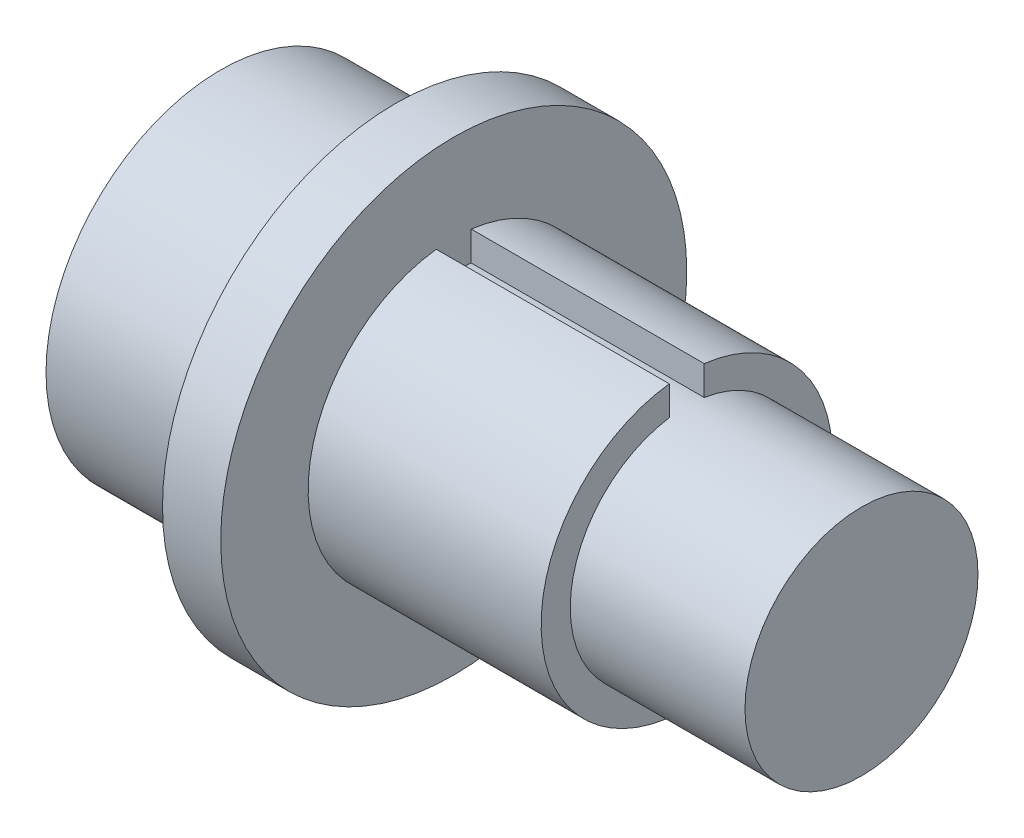
from build123d import *

# Parameters (mm, degrees)
CUT_EXTRUDE1_DEPTH = 40


with BuildPart() as part:
    # Sketch1 → Revolve2 (revolve)
    with BuildSketch(Plane.XY, mode=Mode.PRIVATE) as revolve2_sk:
        Polygon((30, 30), (30, 40), (40, 40), (40, 25), (80, 25), (80, 20), (110, 20), (110, 0), (51.715920118, 0), (0, 0), (0, 30), align=None)
    revolve(revolve2_sk.sketch.rotate(Axis((-14.684767441, 0, 0), (1, 0, 0)), 90), axis=Axis((-14.684767441, 0, 0), (1, 0, 0)))

    # Sketch2 → Cut-Extrude1 (cut)
    with BuildSketch(Plane(origin=(80, 0, 0), x_dir=(0, 0, -1), z_dir=(1, 0, 0))):
        with BuildLine():
            Line((-3, 24.819347292), (-3, 19.773719933))
            ThreePointArc((-3, 19.773719933), (0, 20), (3, 19.773719933))
            Line((3, 19.773719933), (3, 24.819347292))
            ThreePointArc((3, 24.819347292), (0, 25), (-3, 24.819347292))
        make_face()
    extrude(amount=-CUT_EXTRUDE1_DEPTH, mode=Mode.SUBTRACT)


solid = part.part
